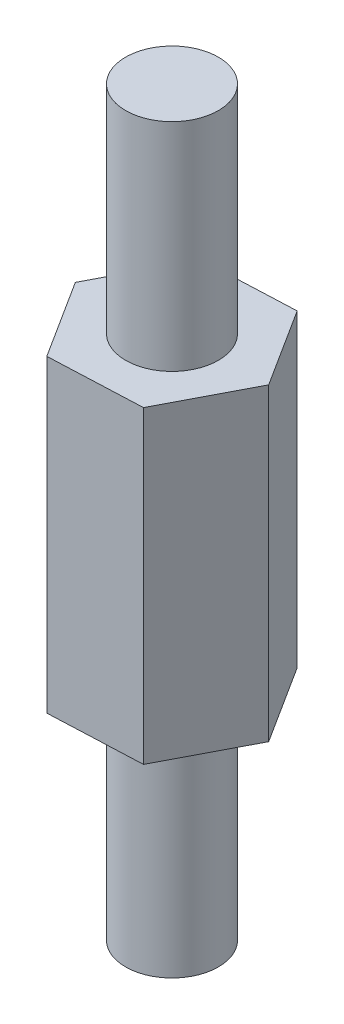
from build123d import *

# Parameters (mm, degrees)
BOSS_EXTRUDE1_DEPTH = 10
SKETCH4_R           = 1.5
BOSS_EXTRUDE2_DEPTH = 7
BOSS_EXTRUDE3_START = 7
SKETCH5_R           = 1.5
BOSS_EXTRUDE3_DEPTH = 7


with BuildPart() as part:
    # Sketch3 → Boss-Extrude1 (new body)
    with BuildSketch(Plane(origin=(0, 0, 0), x_dir=(1, 0, 0), z_dir=(0, 1, 0))):
        Polygon((1.388964752, 2.662182442), (-1.611035248, 2.533969981), (-3, -0.12821246), (-1.388964752, -2.662182442), (1.611035248, -2.533969981), (3, 0.12821246), align=None)
    extrude(amount=BOSS_EXTRUDE1_DEPTH)

    # Sketch4 → Boss-Extrude2 (add)
    with BuildSketch(Plane(origin=(0, 10, 0), x_dir=(1, 0, 0), z_dir=(0, 1, 0))):
        with Locations(Location((0, 0, 0), (0, 0, 270))):
            Circle(SKETCH4_R)
    extrude(amount=BOSS_EXTRUDE2_DEPTH)

    # Sketch5 → Boss-Extrude3 (add)
    with BuildSketch(Plane.XZ.offset(BOSS_EXTRUDE3_START)):
        with Locations(Location((0, 0, 0), (0, 0, 90))):
            Circle(SKETCH5_R)
    extrude(amount=-BOSS_EXTRUDE3_DEPTH)


solid = part.part
